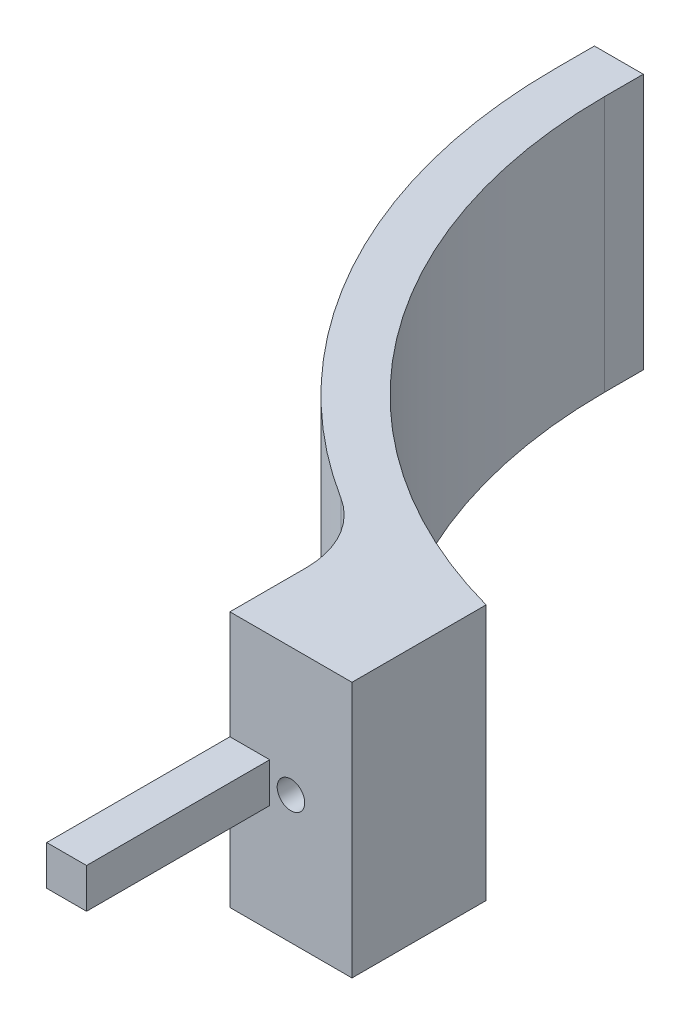
from build123d import *

# Parameters (mm, degrees)
BOSS_EXTRUDE1_DEPTH = 83.88212687
SKETCH5_R           = 4.505
CUT_EXTRUDE1_DEPTH  = 30
SKETCH6_W           = 16
SKETCH6_H           = 83.88212687
BOSS_EXTRUDE2_DEPTH = 12.7
FILLET1_R           = 30
SKETCH7_W           = 13.04
SKETCH7_H           = 13
BOSS_EXTRUDE3_DEPTH = 60
SKETCH8_R           = 1.5
CUT_EXTRUDE2_DEPTH  = 10


with BuildPart() as part:
    # Sketch4 → Boss-Extrude1 (new body)
    with BuildSketch(Plane(origin=(0, 0, 0), x_dir=(1, 0, 0), z_dir=(0, 1, 0))):
        with BuildLine():
            Line((-185.6, 0), (-169.6, 0))
            ThreePointArc((-169.6, 0), (-134.84194303, -102.867926974), (-44.8145, -163.572065432))
            Line((-44.8145, -163.572065432), (-44.8145, -207.49488181))
            Line((-44.8145, -207.49488181), (-84.8, -207.49488181))
            Line((-84.8, -207.49488181), (-84.8, -165.09488181))
            ThreePointArc((-84.8, -165.09488181), (-158.408080602, -96.717320062), (-185.6, 0))
        make_face()
    extrude(amount=-BOSS_EXTRUDE1_DEPTH)

    # Sketch5 → Cut-Extrude1 (cut)
    with BuildSketch(Plane.XY.offset(207.49488181)):
        with Locations((-64.80725, -41.941063435)):
            Circle(SKETCH5_R)
    extrude(amount=-CUT_EXTRUDE1_DEPTH, mode=Mode.SUBTRACT)

    # Sketch6 → Boss-Extrude2 (add)
    with BuildSketch(Plane(origin=(0, 0, 0), x_dir=(-1, 0, 0), z_dir=(0, 0, -1))):
        with Locations((177.6, -41.941063435)):
            Rectangle(SKETCH6_W, SKETCH6_H)
    extrude(amount=BOSS_EXTRUDE2_DEPTH)

    # Fillet1
    fillet1_edges = [part.edges().sort_by_distance(p)[0] for p in [
        (-84.8, -41.941063435, 165.09488181),
    ]]
    fillet(fillet1_edges, radius=FILLET1_R)

    # Sketch7 → Boss-Extrude3 (add)
    with BuildSketch(Plane.XY.offset(207.49488181)):
        with Locations((-78.28, -41.941063435)):
            Rectangle(SKETCH7_W, SKETCH7_H)
    extrude(amount=BOSS_EXTRUDE3_DEPTH)

    # Sketch8 → Cut-Extrude2 (cut)
    with BuildSketch(Plane.ZY.offset(84.8)):
        with Locations((227.49488181, -41.941063435)):
            Circle(SKETCH8_R)
        with Locations((247.49488181, -41.941063435)):
            Circle(SKETCH8_R)
    extrude(amount=-CUT_EXTRUDE2_DEPTH, mode=Mode.SUBTRACT)


solid = part.part
